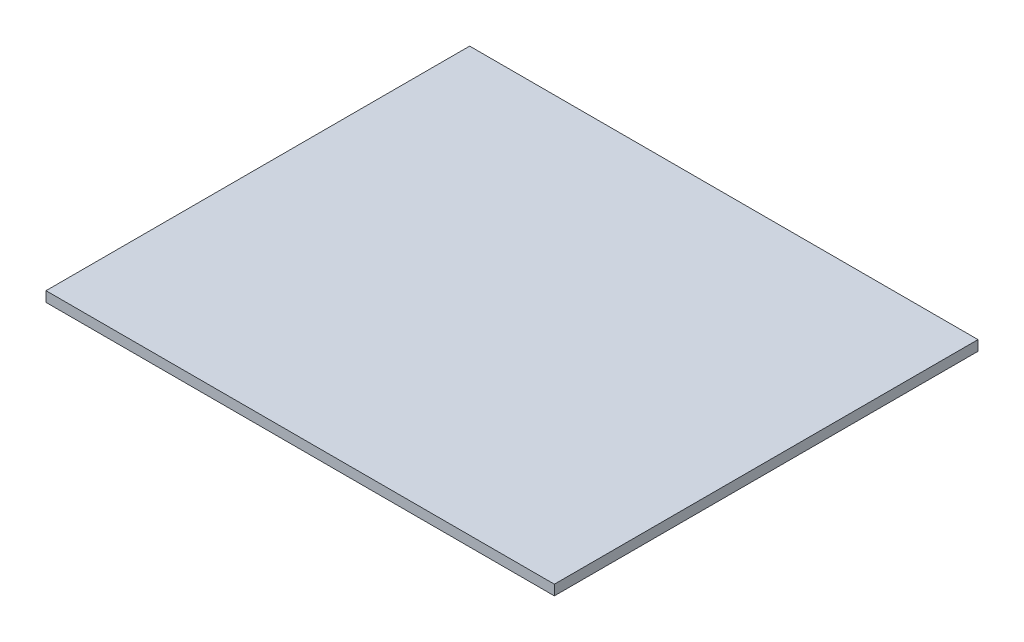
from build123d import *

# Parameters (mm, degrees)
SKETCH1_W           = 60
SKETCH1_H           = 50
BOSS_EXTRUDE1_DEPTH = 1.2


with BuildPart() as part:
    # Sketch1 → Boss-Extrude1 (new body)
    with BuildSketch(Plane(origin=(0, 0, 0), x_dir=(1, 0, 0), z_dir=(0, 1, 0))):
        Rectangle(SKETCH1_W, SKETCH1_H)
    extrude(amount=BOSS_EXTRUDE1_DEPTH)


solid = part.part
